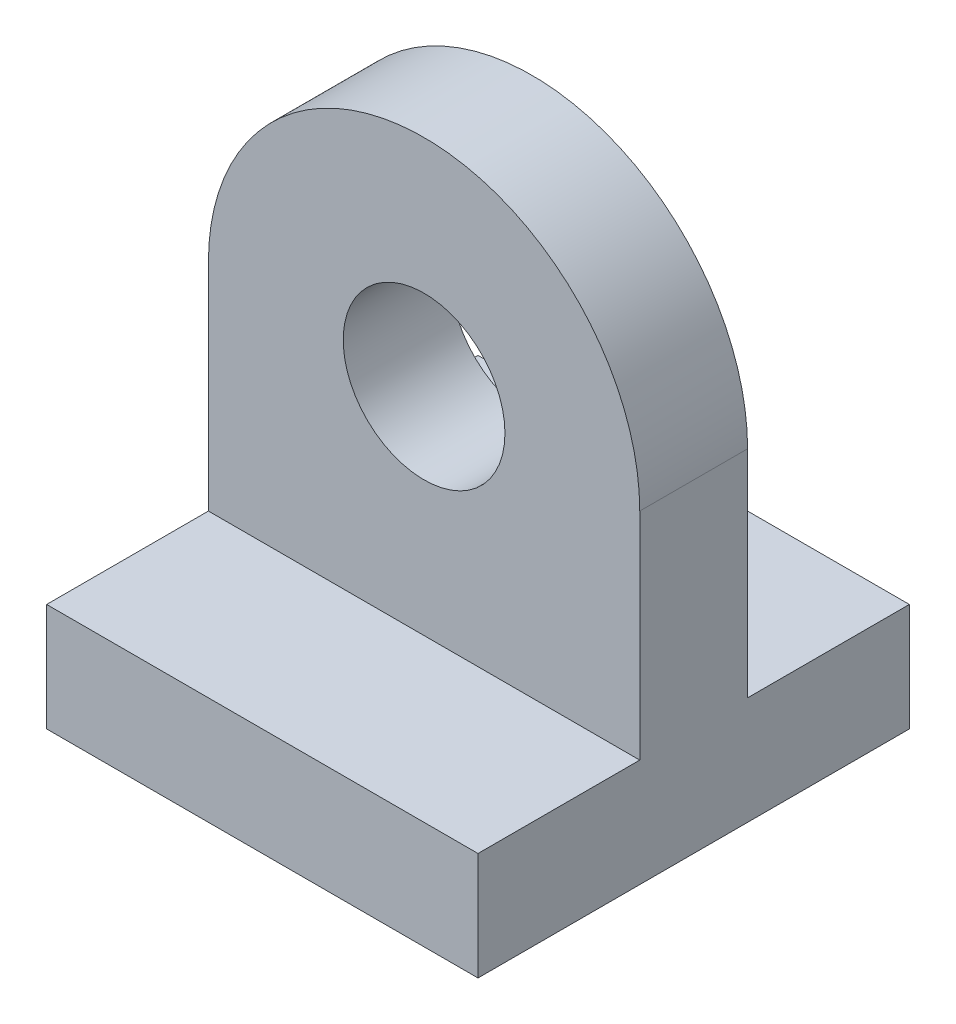
from build123d import *

# Parameters (mm, degrees)
BOSS_EXTRUDE1_DEPTH      = 2
BOSS_EXTRUDE1_DEPTH_BACK = 2
SKETCH1_R                = 3
BOSS_EXTRUDE2_DEPTH      = 8
BOSS_EXTRUDE2_DEPTH_BACK = 8
SKETCH2_W                = 16
SKETCH2_H                = 4


with BuildPart() as part:
    # Sketch1 → Boss-Extrude1 (new, two sides: drawn at the far end of the back side and taken through both)
    with BuildSketch(Plane.XY.offset(-BOSS_EXTRUDE1_DEPTH_BACK)):
        with BuildLine():
            Line((-8, 0), (-8, -12))
            Line((-8, -12), (8, -12))
            Line((8, -12), (8, 0))
            ThreePointArc((8, 0), (0, 8), (-8, 0))
        make_face()
        Circle(SKETCH1_R, mode=Mode.SUBTRACT)
    extrude(amount=BOSS_EXTRUDE1_DEPTH + BOSS_EXTRUDE1_DEPTH_BACK)

    # Sketch2 → Boss-Extrude2 (add, two sides: drawn at the far end of the back side and taken through both)
    with BuildSketch(Plane.XY.offset(-BOSS_EXTRUDE2_DEPTH_BACK)):
        with Locations((0, -10)):
            Rectangle(SKETCH2_W, SKETCH2_H)
    extrude(amount=BOSS_EXTRUDE2_DEPTH + BOSS_EXTRUDE2_DEPTH_BACK)


solid = part.part
